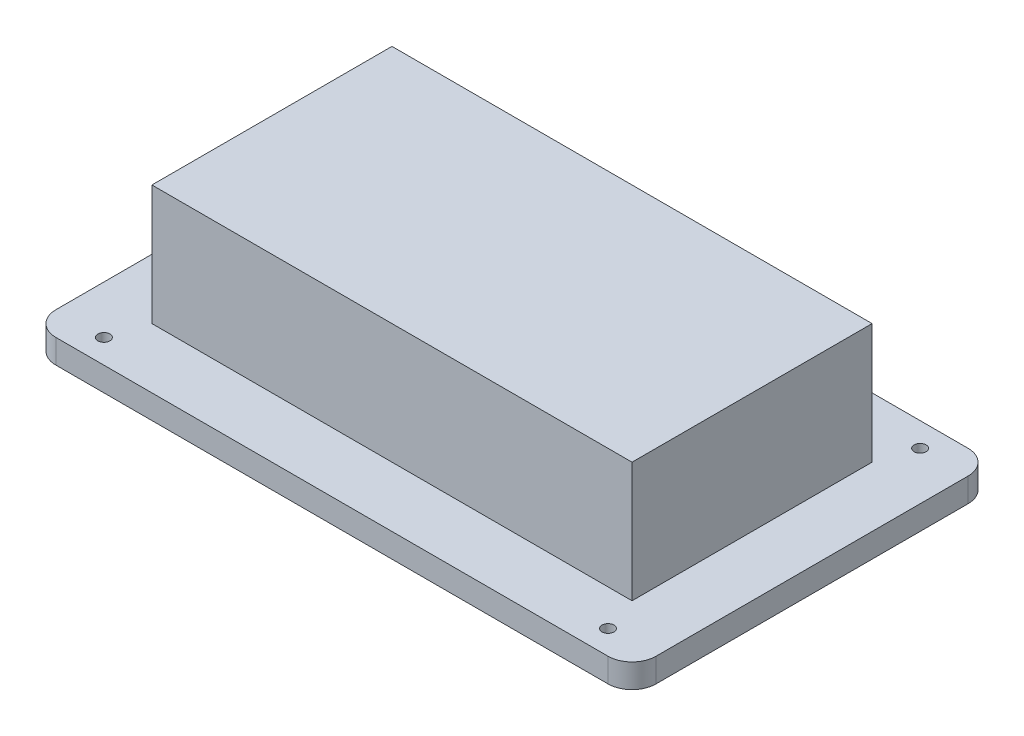
from build123d import *

# Parameters (mm, degrees)
SKETCH_1_W             = 250
SKETCH_1_H             = 150
EXTRUDE_1_DEPTH        = 10
FILLET_1_R             = 10
SKETCH_2_W             = 200
SKETCH_2_H             = 100
EXTRUDE_2_DEPTH        = 50
HOLE_WIZARD_M6_1_D     = 5
HOLE_WIZARD_M6_1_DEPTH = 15
HOLE_WIZARD_M6_1_TIP   = 1.502151548


with BuildPart() as part:
    # 草图1 → 凸台-拉伸1 (new body)
    with BuildSketch(Plane(origin=(0, 0, 0), x_dir=(1, 0, 0), z_dir=(0, 1, 0))):
        Rectangle(SKETCH_1_W, SKETCH_1_H)
    extrude(amount=EXTRUDE_1_DEPTH)

    # 圆角1
    fillet_1_edges = [part.edges().sort_by_distance(p)[0] for p in [
        (125, 5, 75),
        (-125, 5, 75),
        (-125, 5, -75),
        (125, 5, -75),
    ]]
    fillet(fillet_1_edges, radius=FILLET_1_R)

    # 草图2 → 凸台-拉伸2 (add)
    with BuildSketch(Plane(origin=(0, 10, 0), x_dir=(1, 0, 0), z_dir=(0, 1, 0))):
        Rectangle(SKETCH_2_W, SKETCH_2_H)
    extrude(amount=EXTRUDE_2_DEPTH)

    # M6 螺纹孔1
    with Locations(Plane(origin=(0, 10, 0), x_dir=(1, 0, 0), z_dir=(0, 1, 0))):
        with Locations((-105, -65), (105, 65), (-105, 65), (105, -65)):
            Hole(HOLE_WIZARD_M6_1_D / 2, depth=HOLE_WIZARD_M6_1_DEPTH)
            with Locations((0, 0, -(HOLE_WIZARD_M6_1_DEPTH + HOLE_WIZARD_M6_1_TIP / 2))):  # 118° drill point
                Cone(0, HOLE_WIZARD_M6_1_D / 2, HOLE_WIZARD_M6_1_TIP, mode=Mode.SUBTRACT)


solid = part.part
